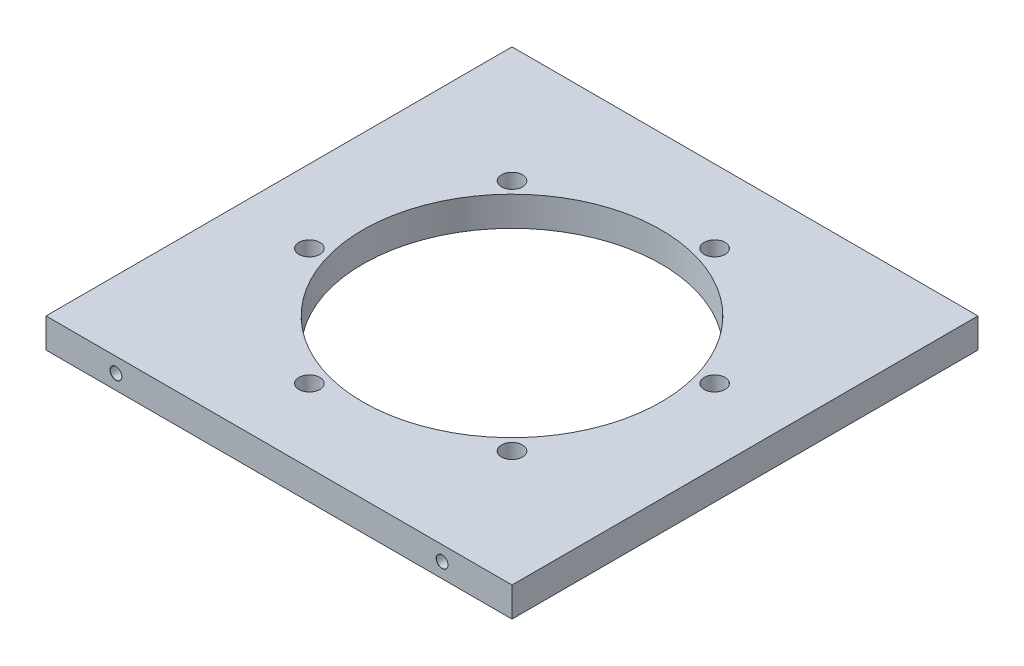
from build123d import *

# Parameters (mm, degrees)
SKETCH1_W                             = 100
SKETCH1_H                             = 100
SKETCH1_R                             = 32
BOSS_EXTRUDE3_DEPTH                   = 6.35
M4_CLEARANCE_HOLE2_D                  = 4.5
M4_CLEARANCE_HOLE2_CSINK_D            = 4.55
M4_CLEARANCE_HOLE2_CSINK_ANGLE        = 90
TAP_DRILL_FOR_M3X0_5_TAP2_D           = 2.5
TAP_DRILL_FOR_M3X0_5_TAP2_DEPTH       = 9.248924226
TAP_DRILL_FOR_M3X0_5_TAP2_CSINK_D     = 2.55
TAP_DRILL_FOR_M3X0_5_TAP2_CSINK_ANGLE = 90
TAP_DRILL_FOR_M3X0_5_TAP2_TIP         = 0.751075774
TAP_DRILL_FOR_M3X0_5_TAP3_D           = 2.5
TAP_DRILL_FOR_M3X0_5_TAP3_DEPTH       = 9.248924226
TAP_DRILL_FOR_M3X0_5_TAP3_CSINK_D     = 2.55
TAP_DRILL_FOR_M3X0_5_TAP3_CSINK_ANGLE = 90
TAP_DRILL_FOR_M3X0_5_TAP3_TIP         = 0.751075774


with BuildPart() as part:
    # Sketch1 → Boss-Extrude3 (new body)
    with BuildSketch(Plane(origin=(0, 0, 0), x_dir=(1, 0, 0), z_dir=(0, 1, 0))):
        Rectangle(SKETCH1_W, SKETCH1_H)
        with Locations(Location((0, 0, 0), (0, 0, 270))):
            Circle(SKETCH1_R, mode=Mode.SUBTRACT)
    extrude(amount=BOSS_EXTRUDE3_DEPTH)

    # M4 Clearance Hole2 (through all)
    with Locations(Plane(origin=(0, 0, 0), x_dir=(-1, 0, 0), z_dir=(0, -1, 0))):
        with Locations((-9.188076101, 34.290366833), (25.102290732, 25.102290732), (34.290366833, -9.188076101), (9.188076101, -34.290366833), (-25.102290732, -25.102290732), (-34.290366833, 9.188076101)):
            CounterSinkHole(M4_CLEARANCE_HOLE2_D / 2, M4_CLEARANCE_HOLE2_CSINK_D / 2, counter_sink_angle=M4_CLEARANCE_HOLE2_CSINK_ANGLE)

    # Tap Drill for M3x0.5 Tap2
    with Locations(Plane.XY.offset(50)):
        with Locations((-35, 3.175), (35, 3.175)):
            CounterSinkHole(TAP_DRILL_FOR_M3X0_5_TAP2_D / 2, TAP_DRILL_FOR_M3X0_5_TAP2_CSINK_D / 2, depth=TAP_DRILL_FOR_M3X0_5_TAP2_DEPTH, counter_sink_angle=TAP_DRILL_FOR_M3X0_5_TAP2_CSINK_ANGLE)
            with Locations((0, 0, -(TAP_DRILL_FOR_M3X0_5_TAP2_DEPTH + TAP_DRILL_FOR_M3X0_5_TAP2_TIP / 2))):  # 118° drill point
                Cone(0, TAP_DRILL_FOR_M3X0_5_TAP2_D / 2, TAP_DRILL_FOR_M3X0_5_TAP2_TIP, mode=Mode.SUBTRACT)

    # Tap Drill for M3x0.5 Tap3
    with Locations(Plane(origin=(0, 0, -50), x_dir=(-1, 0, 0), z_dir=(0, 0, -1))):
        with Locations((-35, 3.175), (35, 3.175)):
            CounterSinkHole(TAP_DRILL_FOR_M3X0_5_TAP3_D / 2, TAP_DRILL_FOR_M3X0_5_TAP3_CSINK_D / 2, depth=TAP_DRILL_FOR_M3X0_5_TAP3_DEPTH, counter_sink_angle=TAP_DRILL_FOR_M3X0_5_TAP3_CSINK_ANGLE)
            with Locations((0, 0, -(TAP_DRILL_FOR_M3X0_5_TAP3_DEPTH + TAP_DRILL_FOR_M3X0_5_TAP3_TIP / 2))):  # 118° drill point
                Cone(0, TAP_DRILL_FOR_M3X0_5_TAP3_D / 2, TAP_DRILL_FOR_M3X0_5_TAP3_TIP, mode=Mode.SUBTRACT)


solid = part.part
